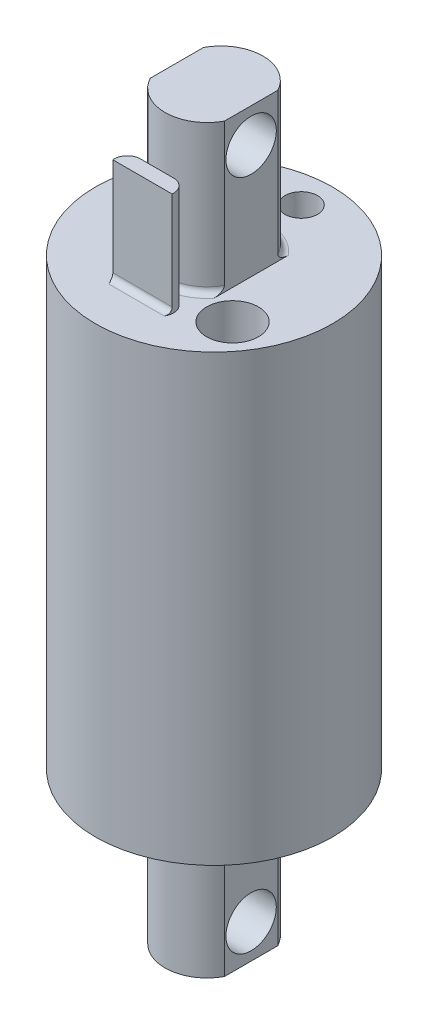
from build123d import *

# Parameters (mm, degrees)
SKETCH2_R           = 8
BOSS_EXTRUDE1_DEPTH = 30
BOSS_EXTRUDE3_DEPTH = 10
BOSS_EXTRUDE4_DEPTH = 7
FILLET1_R           = 0.4
SKETCH12_R          = 1.1
SKETCH12_R_2        = 1.75
CUT_EXTRUDE2_DEPTH  = 42.569219478
SKETCH13_R          = 1.7
CUT_EXTRUDE3_DEPTH  = 43.12296985


with BuildPart() as part:
    # Sketch2 → Boss-Extrude1 (new body)
    with BuildSketch(Plane(origin=(0, 0, 0), x_dir=(1, 0, 0), z_dir=(0, 1, 0))):
        with Locations(Location((0, 0, 0), (0, 0, 270))):
            Circle(SKETCH2_R)
    extrude(amount=BOSS_EXTRUDE1_DEPTH)

    # Sketch4 → Boss-Extrude3 (add)
    with BuildSketch(Plane(origin=(0, 30, 0), x_dir=(1, 0, 0), z_dir=(0, 1, 0))):
        with BuildLine():
            Line((2.504502892, -1.8), (2.504502892, 1.8))
            ThreePointArc((2.504502892, 1.8), (0, 3.30267653), (-2.504502892, 1.8))
            Line((-2.504502892, 1.8), (-2.504502892, -1.8))
            ThreePointArc((-2.504502892, -1.8), (0, -3.30267653), (2.504502892, -1.8))
        make_face()
    boss_extrude3 = extrude(amount=BOSS_EXTRUDE3_DEPTH)

    # Sketch8 → Boss-Extrude4 (add)
    with BuildSketch(Plane(origin=(0, 30, 0), x_dir=(1, 0, 0), z_dir=(0, 1, 0))):
        with BuildLine():
            Line((-1.2, -3.84404132), (1.2, -3.84404132))
            ThreePointArc((1.2, -3.84404132), (1.803521194, -4.169699523), (2, -4.826728575))
            Line((2, -4.826728575), (-2, -4.826728575))
            ThreePointArc((-2, -4.826728575), (-1.803521194, -4.169699523), (-1.2, -3.84404132))
        make_face()
    extrude(amount=BOSS_EXTRUDE4_DEPTH)

    # Fillet1
    fillet1_edges = [part.edges().sort_by_distance(p)[0] for p in [
        (0, 30, 4.826728575),
        (0, 30, -3.30267653),
        (0, 30, 3.30267653),
    ]]
    fillet(fillet1_edges, radius=FILLET1_R)

    # Sketch12 → Cut-Extrude2 (cut, through all)
    with BuildSketch(Plane(origin=(0, 0, 0), x_dir=(1, 0, 0), z_dir=(0, 1, 0))):
        with Locations(Location((0, 5.887857779, 0), (0, 0, 270))):
            Circle(SKETCH12_R)
        with Locations(Location((4.511323968, -3.260456868, 0), (0, 0, 270))):
            Circle(SKETCH12_R_2)
    extrude(amount=CUT_EXTRUDE2_DEPTH, mode=Mode.SUBTRACT)

    # Sketch13 → Cut-Extrude3 (cut, through all)
    with BuildSketch(Plane.ZY.offset(2.504502892)):
        with Locations((0, 37.692003777)):
            Circle(SKETCH13_R)
    cut_extrude3 = extrude(amount=-CUT_EXTRUDE3_DEPTH, mode=Mode.SUBTRACT)

    # Mirror1: Boss-Extrude3, Cut-Extrude3 across plane
    add(boss_extrude3.mirror(Plane.ZX.offset(15)))
    add(cut_extrude3.mirror(Plane.ZX.offset(15)), mode=Mode.SUBTRACT)


solid = part.part
